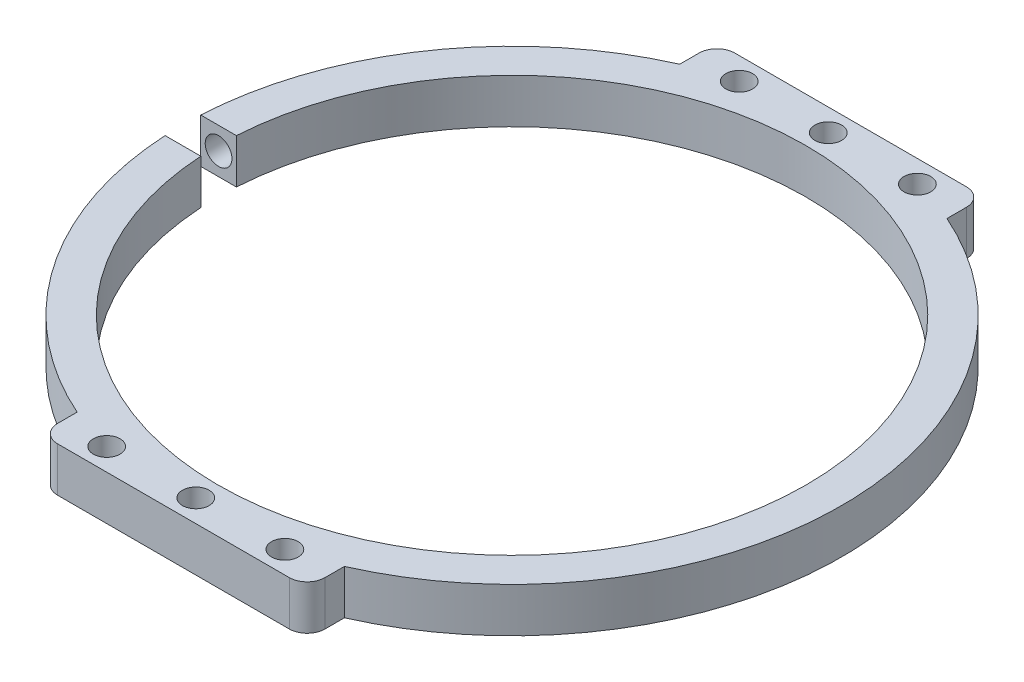
from build123d import *

# Parameters (mm, degrees)
CROQUIS1_R                 = 1.5
SALIENTE_EXTRUIR1_DEPTH    = 5
REDONDEO1_R                = 2
CORTAR_EXTRUIR1_DEPTH      = 20
CORTAR_EXTRUIR1_DEPTH_BACK = 15
CROQUIS3_R                 = 1.5


with BuildPart() as part:
    # Croquis1 → Saliente-Extruir1 (new body)
    with BuildSketch(Plane(origin=(0, 0, 0), x_dir=(1, 0, 0), z_dir=(0, 1, 0))):
        with BuildLine():
            Line((-32.939338184, -2), (-36.945906404, -2))
            ThreePointArc((-36.945906404, -2), (-30.459337304, -21.005446223), (-15, -33.823069051))
            Line((-15, -33.823069051), (-15, -38))
            Line((-15, -38), (15, -38))
            Line((15, -38), (15, -33.823069051))
            ThreePointArc((15, -33.823069051), (37, 0), (15, 33.823069051))
            Line((15, 33.823069051), (15, 38))
            Line((15, 38), (-15, 38))
            Line((-15, 38), (-15, 33.823069051))
            ThreePointArc((-15, 33.823069051), (-30.459337304, 21.005446223), (-36.945906404, 2))
            Line((-36.945906404, 2), (-32.939338184, 2))
            ThreePointArc((-32.939338184, 2), (33, 0), (-32.939338184, -2))
        make_face()
        with Locations((0, -35.5)):
            Circle(CROQUIS1_R, mode=Mode.SUBTRACT)
        with Locations((10, -35.5)):
            Circle(CROQUIS1_R, mode=Mode.SUBTRACT)
        with Locations((-10, -35.5)):
            Circle(CROQUIS1_R, mode=Mode.SUBTRACT)
        with Locations((-10, 35.5)):
            Circle(CROQUIS1_R, mode=Mode.SUBTRACT)
        with Locations((10, 35.5)):
            Circle(CROQUIS1_R, mode=Mode.SUBTRACT)
        with Locations((0, 35.5)):
            Circle(CROQUIS1_R, mode=Mode.SUBTRACT)
    extrude(amount=SALIENTE_EXTRUIR1_DEPTH)

    # Redondeo1
    redondeo1_edges = [part.edges().sort_by_distance(p)[0] for p in [
        (15, 2.5, 38),
        (-15, 2.5, 38),
        (-15, 2.5, -38),
        (15, 2.5, -38),
    ]]
    fillet(redondeo1_edges, radius=REDONDEO1_R)

    # Croquis3 → Cortar-Extruir1 (cut, two sides: drawn at the far end of the back side and taken through both)
    with BuildSketch(Plane(origin=(0, 0, 2), x_dir=(-1, 0, 0), z_dir=(0, 0, -1)).offset(-CORTAR_EXTRUIR1_DEPTH_BACK)):
        with Locations((34.942622294, 2.5)):
            Circle(CROQUIS3_R)
    extrude(amount=CORTAR_EXTRUIR1_DEPTH + CORTAR_EXTRUIR1_DEPTH_BACK, mode=Mode.SUBTRACT)


solid = part.part
